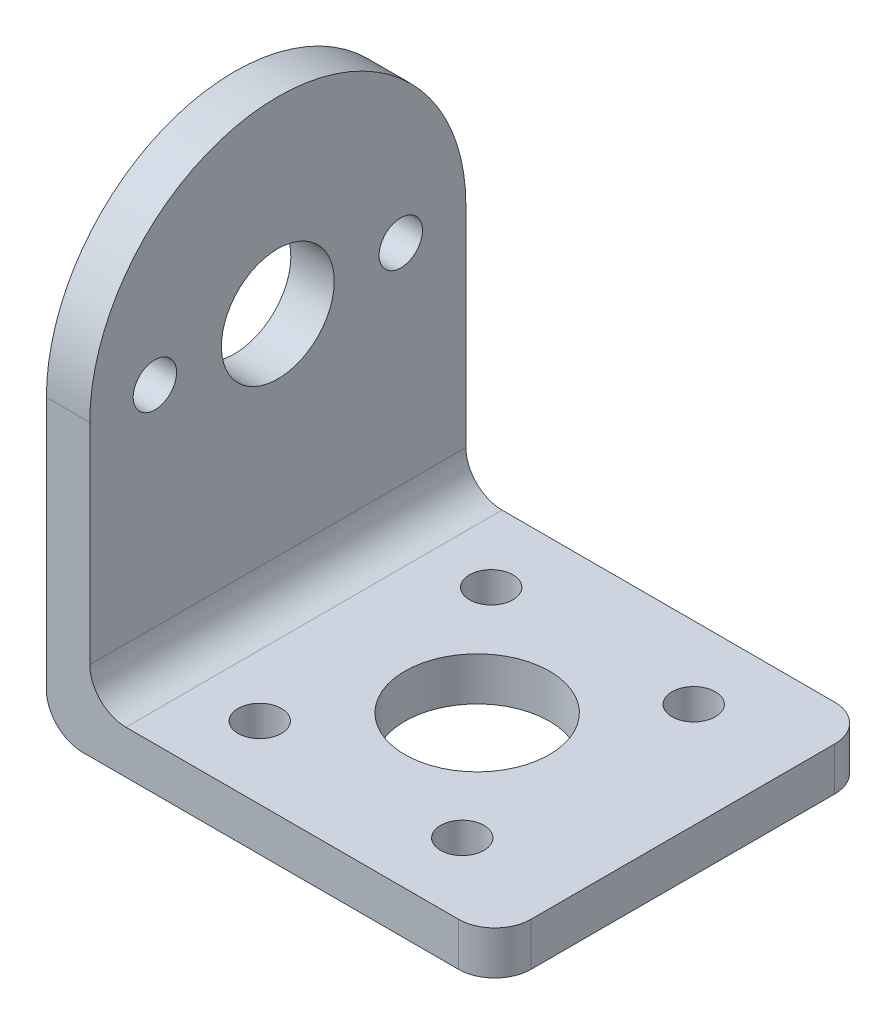
from build123d import *

# Parameters (mm, degrees)
BOSS_EXTRUDE2_DEPTH = 13
FILLET1_R           = 2.5
CUT_EXTRUDE1_DEPTH  = 13
SKETCH4_R           = 1.5
SKETCH4_R_2         = 3.9
CUT_EXTRUDE2_DEPTH  = 13
SKETCH5_R           = 1.5
SKETCH5_R_2         = 5
CUT_EXTRUDE3_DEPTH  = 13


with BuildPart() as part:
    # Sketch1 → Boss-Extrude2 (new, symmetric)
    with BuildSketch(Plane.XY):
        with BuildLine():
            Line((0, 2.5), (0, 33))
            Line((0, 33), (3, 33))
            Line((3, 33), (3, 5.5))
            ThreePointArc((3, 5.5), (3.732233047, 3.732233047), (5.5, 3))
            Line((5.5, 3), (31, 3))
            Line((31, 3), (31, 0))
            Line((31, 0), (2.5, 0))
            ThreePointArc((2.5, 0), (0.732233047, 0.732233047), (0, 2.5))
        make_face()
    extrude(amount=BOSS_EXTRUDE2_DEPTH, both=True)

    # Fillet1
    fillet1_edges = [part.edges().sort_by_distance(p)[0] for p in [
        (31, 1.5, 13),
        (31, 1.5, -13),
    ]]
    fillet(fillet1_edges, radius=FILLET1_R)

    # Sketch3 → Cut-Extrude1 (cut, symmetric)
    with BuildSketch(Plane(origin=(3, 0, 0), x_dir=(0, 0, -1), z_dir=(1, 0, 0))):
        with BuildLine():
            Line((-13, 33), (-13, 20))
            ThreePointArc((-13, 20), (-9.192388155, 29.192388155), (0, 33))
            Line((0, 33), (-13, 33))
        make_face()
        with BuildLine():
            Line((13, 33), (0, 33))
            ThreePointArc((0, 33), (9.192388155, 29.192388155), (13, 20))
            Line((13, 20), (13, 33))
        make_face()
    extrude(amount=CUT_EXTRUDE1_DEPTH, both=True, mode=Mode.SUBTRACT)

    # Sketch4 → Cut-Extrude2 (cut, symmetric)
    with BuildSketch(Plane(origin=(3, 0, 0), x_dir=(0, 0, -1), z_dir=(1, 0, 0))):
        with Locations(Location((-8.5, 20, 0), (0, 0, 90))):
            Circle(SKETCH4_R)
        with Locations(Location((8.5, 20, 0), (0, 0, 90))):
            Circle(SKETCH4_R)
        with Locations(Location((0, 20, 0), (0, 0, 90))):
            Circle(SKETCH4_R_2)
    extrude(amount=CUT_EXTRUDE2_DEPTH, both=True, mode=Mode.SUBTRACT)

    # Sketch5 → Cut-Extrude3 (cut, symmetric)
    with BuildSketch(Plane.XZ):
        with Locations(Location((23.75, 8, 0), (0, 0, 270))):
            Circle(SKETCH5_R)
        with Locations(Location((23.75, -8, 0), (0, 0, 270))):
            Circle(SKETCH5_R)
        with Locations(Location((9.75, 8, 0), (0, 0, 270))):
            Circle(SKETCH5_R)
        with Locations(Location((9.75, -8, 0), (0, 0, 270))):
            Circle(SKETCH5_R)
        with Locations(Location((16.780453702, 0, 0), (0, 0, 270))):
            Circle(SKETCH5_R_2)
    extrude(amount=CUT_EXTRUDE3_DEPTH, both=True, mode=Mode.SUBTRACT)


solid = part.part
